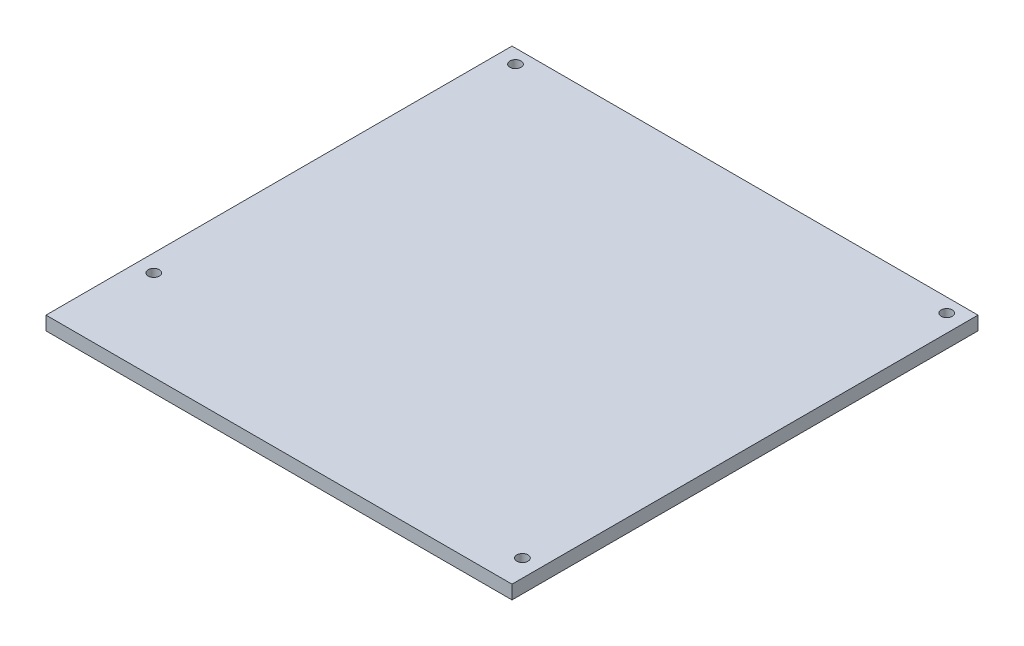
from build123d import *

# Parameters (mm, degrees)
SKETCH1_W                 = 170.18
SKETCH1_H                 = 170.18
BOSS_EXTRUDE1_DEPTH       = 5
F_0_16_1_DIAMETER_HOLE1_D = 4.064


with BuildPart() as part:
    # Sketch1 → Boss-Extrude1 (new body)
    with BuildSketch(Plane(origin=(0, 0, 0), x_dir=(1, 0, 0), z_dir=(0, 1, 0))):
        Rectangle(SKETCH1_W, SKETCH1_H)
    extrude(amount=BOSS_EXTRUDE1_DEPTH)

    # 0.16 (1) Diameter Hole1 (through all)
    with Locations(Plane(origin=(0, 5, 0), x_dir=(-1, 0, 0), z_dir=(0, 1, 0))):
        with Locations((78.74, -80.01), (-78.74, -80.01), (-78.74, 74.93), (78.74, 52.07)):
            Hole(F_0_16_1_DIAMETER_HOLE1_D / 2)


solid = part.part
